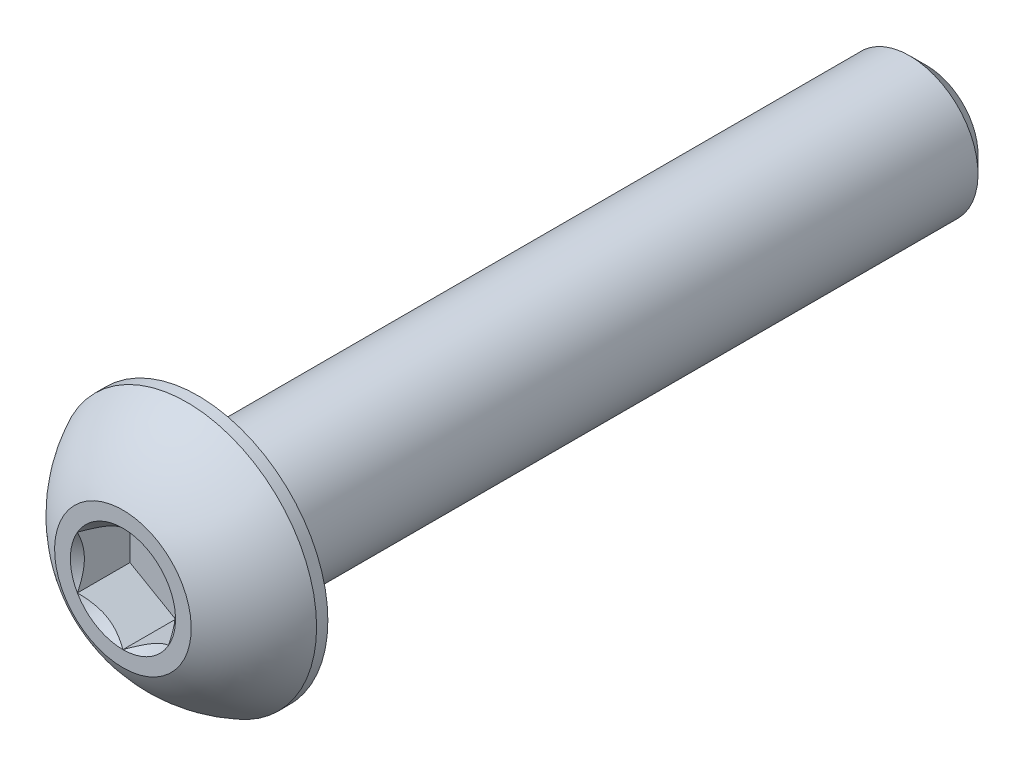
from build123d import *

# Parameters (mm, degrees)
SKETCH1_W              = 16
SKETCH1_H              = 1.5
CUT_EXTRUDE2_DEPTH     = 1.155
SPLIT1_SURFACE_1_BACK  = 20.404
SPLIT1_SURFACE_1_DEPTH = 40.808
SPLIT1_SURFACE_2_BACK  = 20.404
SPLIT1_SURFACE_2_DEPTH = 40.808
CHAMFER1_SIZE          = 0.375


with BuildPart() as part:
    # Sketch1 → Revolve1 (revolve)
    with BuildSketch(Plane(origin=(0, 0, 0), x_dir=(0, 0, -1), z_dir=(1, 0, 0))):
        with Locations((9.65, 0.75)):
            Rectangle(SKETCH1_W, SKETCH1_H)
    revolve(axis=Axis((0, 0, -17.65), (0, 0, 1)))

    # Sketch7 → Revolve2 (revolve)
    with BuildSketch(Plane(origin=(0, 0, 0), x_dir=(0, 0, -1), z_dir=(1, 0, 0))):
        with BuildLine():
            Line((1.4025, 2.85), (1.65, 2.85))
            Line((1.65, 2.85), (1.65, 0))
            Line((1.65, 0), (0, 0))
            Line((0, 0), (0, 1.5))
            ThreePointArc((0, 1.5), (0.59512511, 2.285251969), (1.4025, 2.85))
        make_face()
    revolve(axis=Axis((0, 0, 0), (0, 0, -1)))

    # Sketch5 → Cut-Extrude2 (cut)
    with BuildSketch(Plane.XY):
        Polygon((1, -0.577350269), (1, 0.577350269), (0, 1.154700538), (-1, 0.577350269), (-1, -0.577350269), (0, -1.154700538), align=None)
    extrude(amount=-CUT_EXTRUDE2_DEPTH, mode=Mode.SUBTRACT)

    # Cut-Extrude3 cone 1 section (through the dimple's axis) → Cut-Extrude3 (revolve, cut)
    with BuildSketch(Plane(origin=(0, 0, 0), x_dir=(0, -1, 0), z_dir=(1, 0, 0))):
        Polygon((0, 0), (1.154700538, 0), (0, 1.154700538), align=None)
    revolve(axis=Axis((0, 0, 0), (0, 0, -1)), mode=Mode.SUBTRACT)


with BuildPart() as body_2:
    # Split1: the piece behind the surface
    add(part.part)
    # Split1 surface: a surface, the sketch's curves swept straight by 40.808 mm
    with BuildLine(Plane(origin=(0, 0, 0), x_dir=(0, 0, -1), z_dir=(1, 0, 0)).offset(-SPLIT1_SURFACE_1_BACK), mode=Mode.PRIVATE) as split1_surface_1_path:
        Line((1.65, -2.85), (1.65, 2.85))
    split1_surface_1 = Shell.extrude(split1_surface_1_path.wire(), (1 * SPLIT1_SURFACE_1_DEPTH, 0 * SPLIT1_SURFACE_1_DEPTH, 0 * SPLIT1_SURFACE_1_DEPTH))
    split(bisect_by=split1_surface_1, keep=Keep.BOTTOM)

    # Chamfer1
    chamfer1_edges = [body_2.edges().sort_by_distance(p)[0] for p in [
        (0, -1.5, -17.65),
    ]]
    chamfer(chamfer1_edges, length=CHAMFER1_SIZE)


with BuildPart() as part_1:
    add(part.part)

    # Split1: split by a surface, the side it looks to stays
    # Split1 surface: a surface, the sketch's curves swept straight by 40.808 mm
    with BuildLine(Plane(origin=(0, 0, 0), x_dir=(0, 0, -1), z_dir=(1, 0, 0)).offset(-SPLIT1_SURFACE_2_BACK), mode=Mode.PRIVATE) as split1_surface_2_path:
        Line((1.65, -2.85), (1.65, 2.85))
    split1_surface_2 = Shell.extrude(split1_surface_2_path.wire(), (1 * SPLIT1_SURFACE_2_DEPTH, 0 * SPLIT1_SURFACE_2_DEPTH, 0 * SPLIT1_SURFACE_2_DEPTH))
    split(bisect_by=split1_surface_2, keep=Keep.TOP)


solid = Compound([body_2.part, part_1.part])
